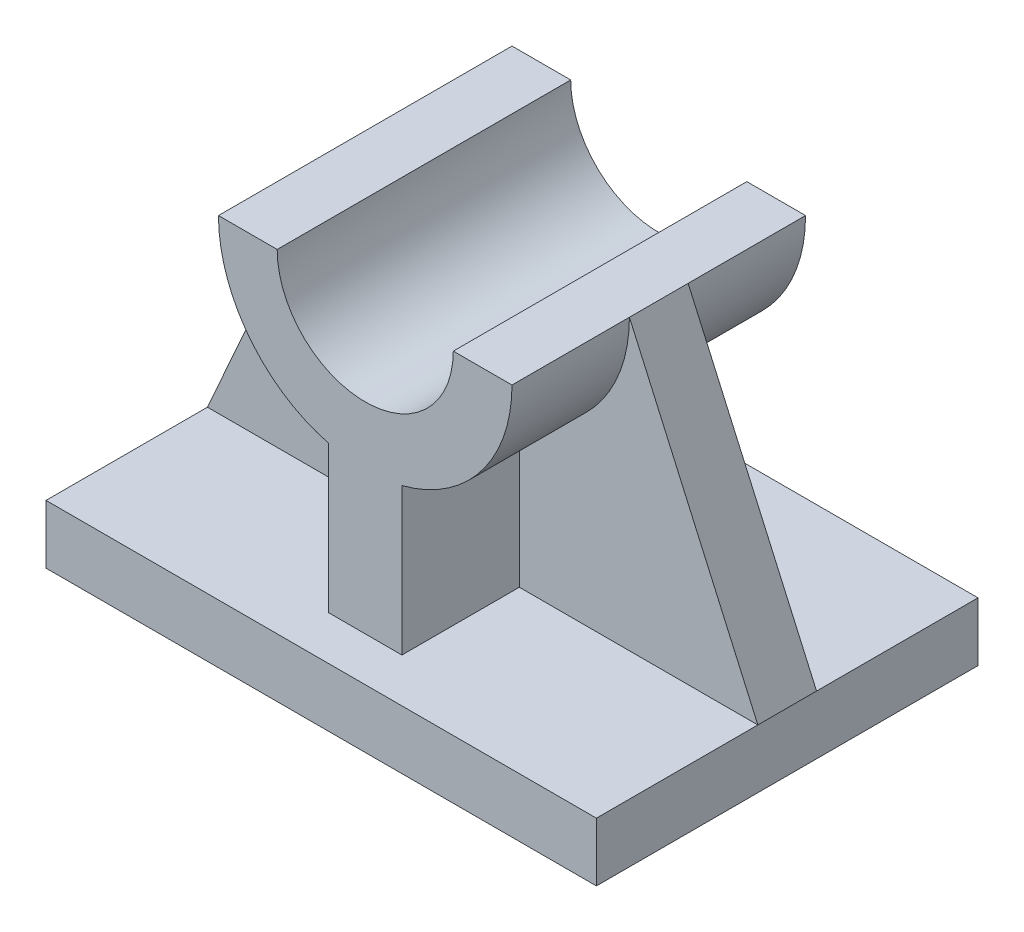
from build123d import *

# Parameters (mm, degrees)
BOSS_EXTRUDE1_DEPTH = 26
BOSS_EXTRUDE3_DEPTH = 20
BOSS_EXTRUDE4_DEPTH = 4


with BuildPart() as part:
    # Sketch2 → Boss-Extrude1 (new, symmetric)
    with BuildSketch(Plane.XY):
        Polygon((5, 4), (-5, 4), (-37.5, 4), (-37.5, -4), (37.5, -4), (37.5, 4), align=None)
    extrude(amount=BOSS_EXTRUDE1_DEPTH, both=True)

    # Sketch2<4> → Boss-Extrude3 (add, symmetric)
    with BuildSketch(Plane.XY):
        with BuildLine():
            Line((-5, 24), (-5, 4))
            Line((-5, 4), (5, 4))
            Line((5, 4), (5, 24))
            ThreePointArc((5, 24), (15.811388301, 31.117468017), (20, 43.364916731))
            Line((20, 43.364916731), (12, 43.364916731))
            ThreePointArc((12, 43.364916731), (0, 31.364916731), (-12, 43.364916731))
            Line((-12, 43.364916731), (-20, 43.364916731))
            ThreePointArc((-20, 43.364916731), (-15.811388301, 31.117468017), (-5, 24))
        make_face()
    extrude(amount=BOSS_EXTRUDE3_DEPTH, both=True)

    # Sketch2<6> → Boss-Extrude4 (add, symmetric)
    with BuildSketch(Plane.XY):
        with BuildLine():
            Line((-37.5, 4), (-5, 4))
            Line((-5, 4), (-5, 24))
            ThreePointArc((-5, 24), (-15.811388301, 31.117468017), (-20, 43.364916731))
            Line((-20, 43.364916731), (-37.5, 4))
        make_face()
        with BuildLine():
            Line((5, 24), (5, 4))
            Line((5, 4), (37.5, 4))
            Line((37.5, 4), (20, 43.364916731))
            ThreePointArc((20, 43.364916731), (15.811388301, 31.117468017), (5, 24))
        make_face()
    extrude(amount=BOSS_EXTRUDE4_DEPTH, both=True)


solid = part.part
